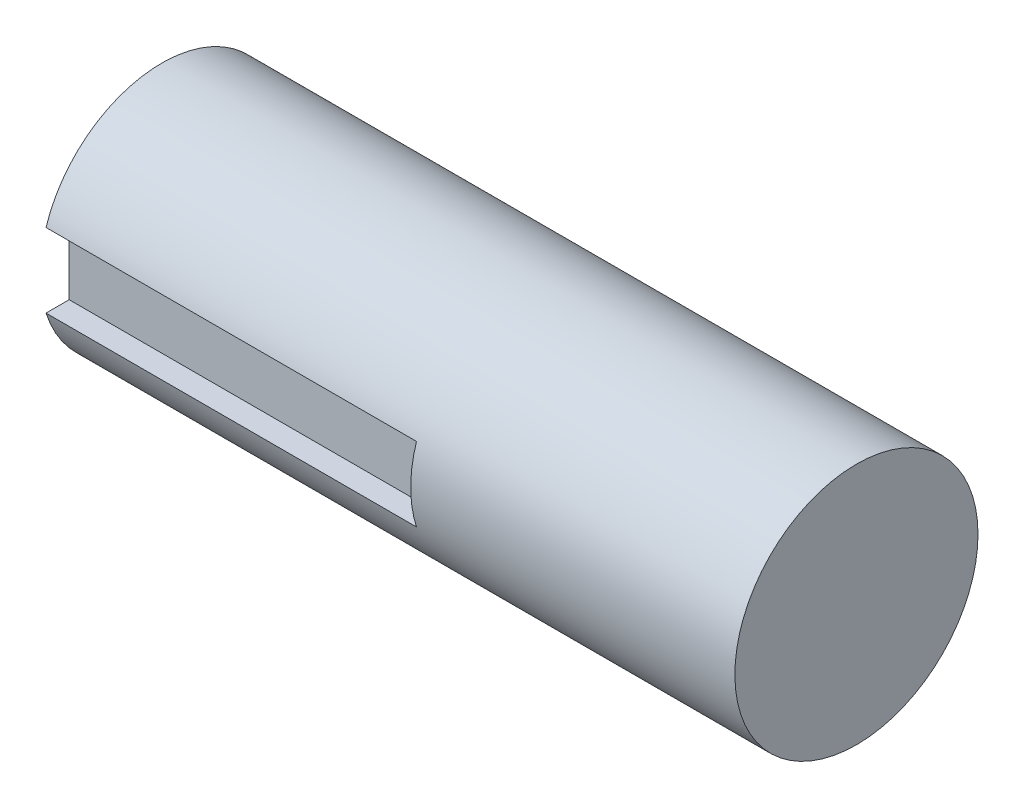
from build123d import *

# Parameters (mm, degrees)
SKETCH1_R           = 52.5
BOSS_EXTRUDE1_DEPTH = 300
CUT_EXTRUDE1_DEPTH  = 160


with BuildPart() as part:
    # Sketch1 → Boss-Extrude1 (new body)
    with BuildSketch(Plane.YZ):
        with Locations(Location((0, 0, 0), (0, 0, 270))):
            Circle(SKETCH1_R)
    extrude(amount=BOSS_EXTRUDE1_DEPTH)

    # Sketch2 → Cut-Extrude1 (cut)
    with BuildSketch(Plane(origin=(0, 0, 0), x_dir=(0, -1, 0), z_dir=(-1, 0, 0))):
        with BuildLine():
            Line((-16, 40.002499938), (16, 40.002499938))
            Line((16, 40.002499938), (16, 50.002499938))
            ThreePointArc((16, 50.002499938), (0, 52.5), (-16, 50.002499938))
            Line((-16, 50.002499938), (-16, 40.002499938))
        make_face()
    extrude(amount=-CUT_EXTRUDE1_DEPTH, mode=Mode.SUBTRACT)


solid = part.part
